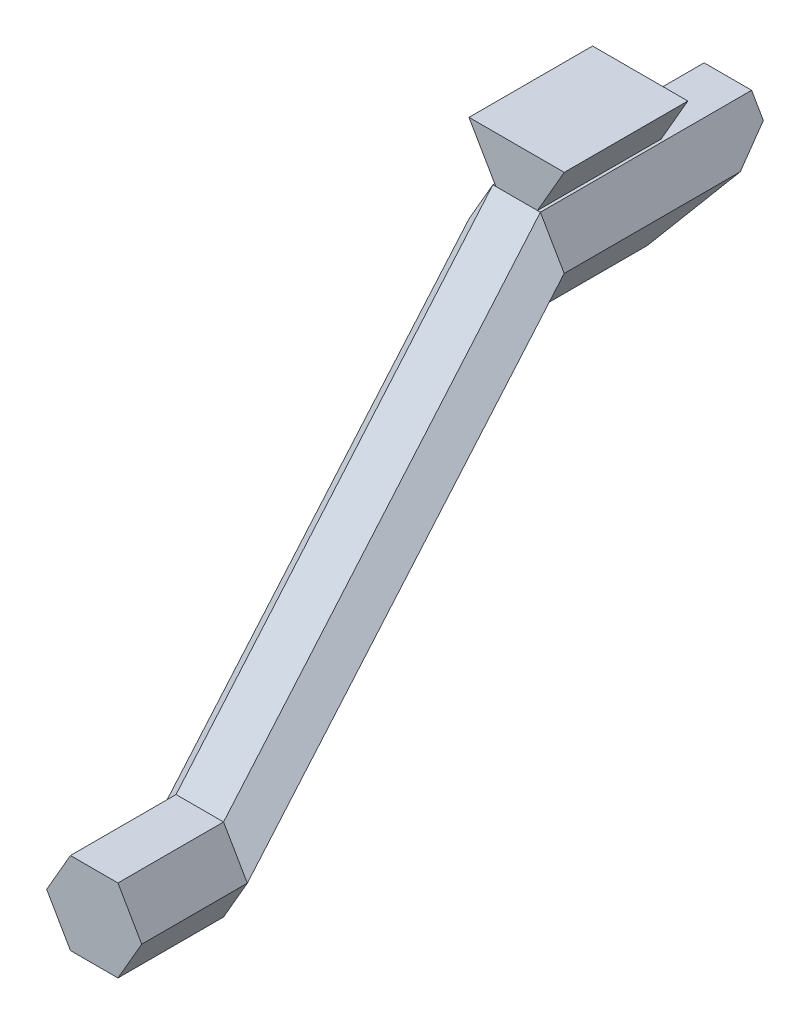
from build123d import *

# Parameters (mm, degrees)
BOSS_EXTRUDE1_DEPTH = 25.4
BOSS_EXTRUDE2_DEPTH = 12.7
BOSS_EXTRUDE3_DEPTH = 25.4
CHAMFER1_SIZE       = 7.46
CHAMFER1_SIZE2      = 12.54
CUT_EXTRUDE1_DEPTH  = 10.16
CUT_EXTRUDE3_DEPTH  = 83.695754046
CHAMFER7_SIZE       = 0.381


with BuildPart() as part:
    # Sketch1 → Boss-Extrude1 (new body)
    with BuildSketch(Plane.XY):
        Polygon((5.715, 0), (2.8575, 4.949335183), (-2.8575, 4.949335183), (-5.715, 0), (-2.8575, -4.949335183), (2.8575, -4.949335183), align=None)
    extrude(amount=BOSS_EXTRUDE1_DEPTH)



with BuildPart() as body_2:
    # Sketch2 → Boss-Extrude2 (new body)
    with BuildSketch(Plane.XY.offset(63.5)):
        Polygon((-2.8575, -49.399335183), (2.8575, -49.399335183), (5.715, -44.45), (2.8575, -39.500664817), (-2.8575, -39.500664817), (-5.715, -44.45), align=None)
    extrude(amount=BOSS_EXTRUDE2_DEPTH)


with BuildPart() as part_1:
    add(part.part)

    add(body_2.part)  # loft1 joins it to this body
    # loft from a face of the part (loft1)
    loft([part_1.faces().sort_by_distance((0, 0, 25.4))[0], part_1.faces().sort_by_distance((0, -44.45, 63.5))[0]])

    # Sketch4 → Boss-Extrude3 (add)
    with BuildSketch(Plane(origin=(0, 0, 0), x_dir=(-1, 0, 0), z_dir=(0, 0, -1))):
        Polygon((2.8575, 4.949335183), (6.083733304, 10.537335183), (-6.083733304, 10.537335183), (-2.8575, 4.949335183), align=None)
    extrude(amount=-BOSS_EXTRUDE3_DEPTH)

    # Chamfer1
    chamfer1_edges = [part_1.edges().sort_by_distance(p)[0] for p in [
        (0, -4.949335183, 0),
    ]]
    chamfer1_side = [part_1.faces().sort_by_distance(p)[0] for p in [
        (0, 2.994180076, 0),
    ]]
    chamfer(chamfer1_edges, length=CHAMFER1_SIZE, length2=CHAMFER1_SIZE2, reference=chamfer1_side[0])

    # Sketch8 → Cut-Extrude1 (cut)
    with BuildSketch(Plane(origin=(0, 0, 0), x_dir=(-1, 0, 0), z_dir=(0, 0, -1))):
        Polygon((-6.083733304, 10.537335183), (6.083733304, 10.537335183), (2.8575, 4.949335183), (-2.8575, 4.949335183), align=None)
    extrude(amount=-CUT_EXTRUDE1_DEPTH, mode=Mode.SUBTRACT)

    # Sketch9 → Cut-Extrude3 (cut, through all)
    with BuildSketch(Plane(origin=(0, 0, 10.16), x_dir=(-1, 0, 0), z_dir=(0, 0, -1))):
        Polygon((5.728133304, 10.537335183), (2.5019, 4.949335183), (2.8575, 4.949335183), (6.083733304, 10.537335183), align=None)
        Polygon((-2.5019, 4.949335183), (-5.728133304, 10.537335183), (-6.083733304, 10.537335183), (-2.8575, 4.949335183), align=None)
    extrude(amount=-CUT_EXTRUDE3_DEPTH, mode=Mode.SUBTRACT)

    # Chamfer7
    chamfer7_edges = [part_1.edges().sort_by_distance(p)[0] for p in [
        (4.115016652, 7.743335183, 10.16),
        (-4.115016652, 7.743335183, 10.16),
        (0, 10.537335183, 10.16),
    ]]
    chamfer(chamfer7_edges, length=CHAMFER7_SIZE)


solid = part_1.part
